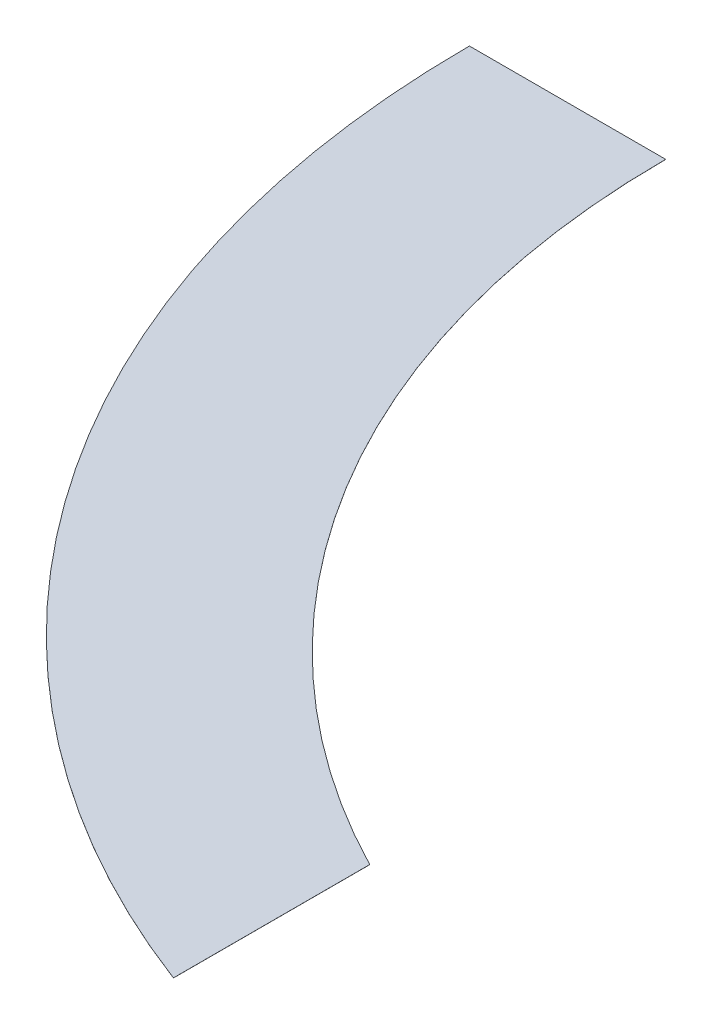
from build123d import *

# Parameters (mm, degrees)
RESSALTO_EXTRUS_O16_DEPTH = 0.01


with BuildPart() as part:
    # Esboço1 → Ressalto-extrusão16 (new body)
    with BuildSketch(Plane(origin=(0, 0, 0), x_dir=(1, 0, 0), z_dir=(0, 1, 0))):
        with BuildLine():
            Line((-1736.402214806, 241.27806063), (-1736.402214806, 221.27806063))
            ThreePointArc((-1736.402214806, 221.27806063), (-1785.140022171, 259.473601593), (-1803.558877077, 318.592287302))
            Line((-1803.558877077, 318.592287302), (-1783.558877077, 318.592287302))
            ThreePointArc((-1783.558877077, 318.592287302), (-1770.839466155, 273.311937142), (-1736.402214806, 241.27806063))
        make_face()
    extrude(amount=RESSALTO_EXTRUS_O16_DEPTH)


solid = part.part
